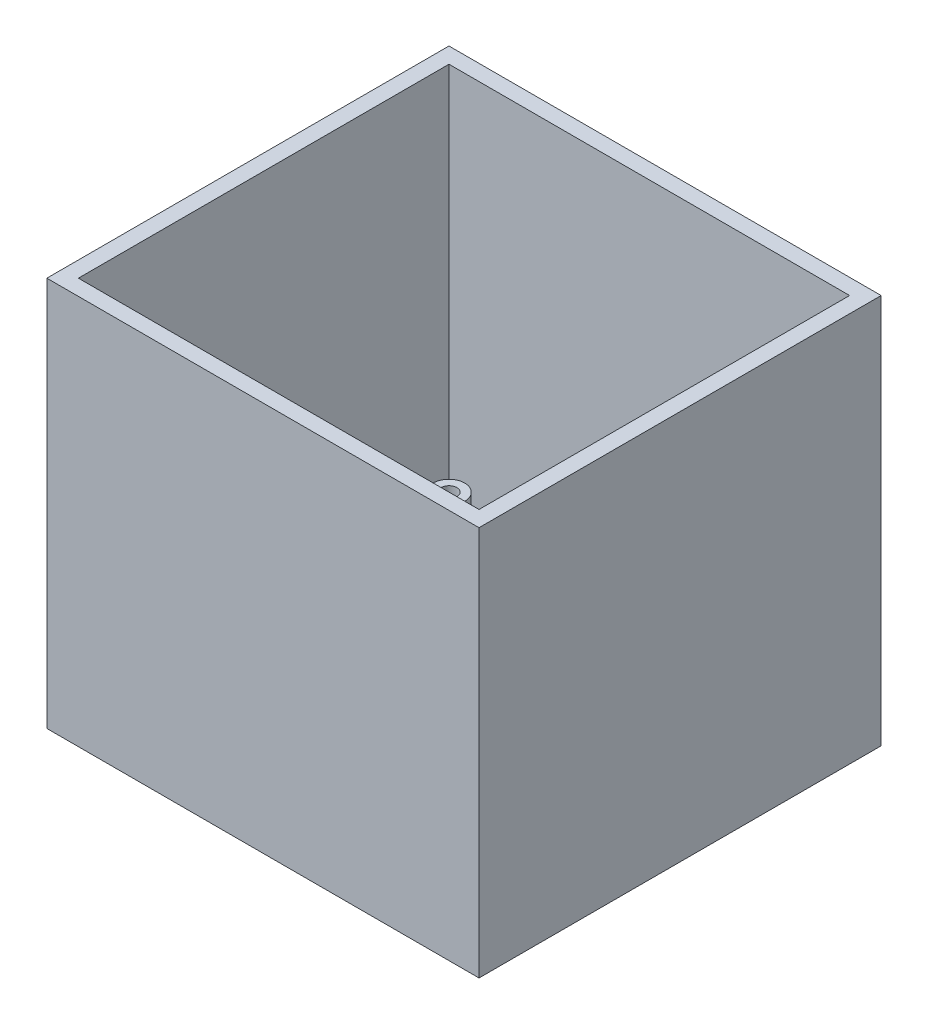
from build123d import *

# Parameters (mm, degrees)
SKETCH1_W           = 54.800000096
SKETCH1_H           = 50.990000096
BOSS_EXTRUDE2_DEPTH = 2
SKETCH2_R           = 2
SKETCH2_R_2         = 1
BOSS_EXTRUDE3_DEPTH = 3
SKETCH3_W           = 54.800000096
SKETCH3_H           = 50.990000096
SKETCH3_W_2         = 50.800000096
SKETCH3_H_2         = 46.990000096
BOSS_EXTRUDE5_DEPTH = 47.45


with BuildPart() as part:
    # Sketch1 → Boss-Extrude2 (new body)
    with BuildSketch(Plane(origin=(0, 0, 0), x_dir=(1, 0, 0), z_dir=(0, 1, 0))):
        Rectangle(SKETCH1_W, SKETCH1_H)
    extrude(amount=BOSS_EXTRUDE2_DEPTH)

    # Sketch2 → Boss-Extrude3 (add)
    # profile 1 of 4: a face of its own
    with BuildSketch(Plane(origin=(0, 2, 0), x_dir=(1, 0, 0), z_dir=(0, 1, 0))):
        with Locations(Location((-22.86, 20.955, 0), (0, 0, 90))):
            Circle(SKETCH2_R)
        with Locations(Location((-22.86, 20.955, 0), (0, 0, 270))):
            Circle(SKETCH2_R_2, mode=Mode.SUBTRACT)
    # profile 2 of 4: a face of its own
    with BuildSketch(Plane(origin=(0, 2, 0), x_dir=(1, 0, 0), z_dir=(0, 1, 0))):
        with Locations(Location((22.86, 20.955, 0), (0, 0, 90))):
            Circle(SKETCH2_R)
        with Locations(Location((22.86, 20.955, 0), (0, 0, 270))):
            Circle(SKETCH2_R_2, mode=Mode.SUBTRACT)
    # profile 3 of 4: a face of its own
    with BuildSketch(Plane(origin=(0, 2, 0), x_dir=(1, 0, 0), z_dir=(0, 1, 0))):
        with Locations(Location((22.86, -20.955, 0), (0, 0, 90))):
            Circle(SKETCH2_R)
        with Locations(Location((22.86, -20.955, 0), (0, 0, 270))):
            Circle(SKETCH2_R_2, mode=Mode.SUBTRACT)
    # profile 4 of 4: a face of its own
    with BuildSketch(Plane(origin=(0, 2, 0), x_dir=(1, 0, 0), z_dir=(0, 1, 0))):
        with Locations(Location((-22.86, -20.955, 0), (0, 0, 90))):
            Circle(SKETCH2_R)
        with Locations(Location((-22.86, -20.955, 0), (0, 0, 270))):
            Circle(SKETCH2_R_2, mode=Mode.SUBTRACT)
    extrude(amount=BOSS_EXTRUDE3_DEPTH)

    # Sketch3 → Boss-Extrude5 (add)
    with BuildSketch(Plane(origin=(0, 2, 0), x_dir=(1, 0, 0), z_dir=(0, 1, 0))):
        Rectangle(SKETCH3_W, SKETCH3_H)
        Rectangle(SKETCH3_W_2, SKETCH3_H_2, mode=Mode.SUBTRACT)
    extrude(amount=BOSS_EXTRUDE5_DEPTH)


solid = part.part
